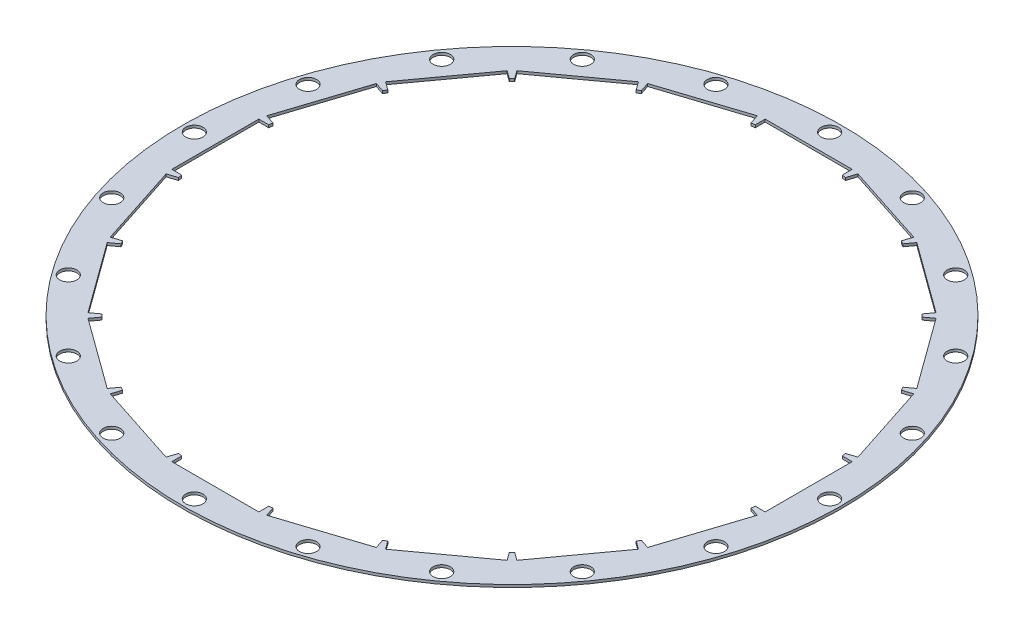
from build123d import *

# Parameters (mm, degrees)
SKETCH1_R           = 2.6
BOSS_EXTRUDE1_DEPTH = 0.79375
CIRPATTERN1_COUNT   = 20


with BuildPart() as part:
    # Sketch1 → Boss-Extrude1 (new body)
    with BuildSketch(Plane(origin=(0, 0, 0), x_dir=(1, 0, 0), z_dir=(0, 1, 0))):
        with BuildLine():
            Line((-15.643446504, 98.76883406), (-13.77106769, 86.947099487))
            Line((-13.77106769, 86.947099487), (-13.2, 87.037547723))
            Line((-13.2, 87.037547723), (-13.2, 90.037547723))
            Line((-13.2, 90.037547723), (13.2, 90.037547723))
            Line((13.2, 90.037547723), (13.2, 87.037547723))
            Line((13.2, 87.037547723), (13.77106769, 86.947099487))
            Line((13.77106769, 86.947099487), (15.643446504, 98.76883406))
            ThreePointArc((15.643446504, 98.76883406), (0, 100), (-15.643446504, 98.76883406))
        make_face()
        with Locations(Location((0, 96.4, 0), (0, 0, 270))):
            Circle(SKETCH1_R, mode=Mode.SUBTRACT)
    extrude(amount=BOSS_EXTRUDE1_DEPTH)


with BuildPart() as cirpattern1_1:
    # CirPattern1: pattern copy
    add(part.part.rotate(Axis((0, 0, 0), (0, 1, 0)), 1 * 360 / CIRPATTERN1_COUNT))


with BuildPart() as cirpattern1_2:
    # CirPattern1: pattern copy
    add(part.part.rotate(Axis((0, 0, 0), (0, 1, 0)), 2 * 360 / CIRPATTERN1_COUNT))


with BuildPart() as cirpattern1_3:
    # CirPattern1: pattern copy
    add(part.part.rotate(Axis((0, 0, 0), (0, 1, 0)), 3 * 360 / CIRPATTERN1_COUNT))


with BuildPart() as cirpattern1_4:
    # CirPattern1: pattern copy
    add(part.part.rotate(Axis((0, 0, 0), (0, 1, 0)), 4 * 360 / CIRPATTERN1_COUNT))


with BuildPart() as cirpattern1_5:
    # CirPattern1: pattern copy
    add(part.part.rotate(Axis((0, 0, 0), (0, 1, 0)), 5 * 360 / CIRPATTERN1_COUNT))


with BuildPart() as cirpattern1_6:
    # CirPattern1: pattern copy
    add(part.part.rotate(Axis((0, 0, 0), (0, 1, 0)), 6 * 360 / CIRPATTERN1_COUNT))


with BuildPart() as cirpattern1_7:
    # CirPattern1: pattern copy
    add(part.part.rotate(Axis((0, 0, 0), (0, 1, 0)), 7 * 360 / CIRPATTERN1_COUNT))


with BuildPart() as cirpattern1_8:
    # CirPattern1: pattern copy
    add(part.part.rotate(Axis((0, 0, 0), (0, 1, 0)), 8 * 360 / CIRPATTERN1_COUNT))


with BuildPart() as cirpattern1_9:
    # CirPattern1: pattern copy
    add(part.part.rotate(Axis((0, 0, 0), (0, 1, 0)), 9 * 360 / CIRPATTERN1_COUNT))


with BuildPart() as cirpattern1_10:
    # CirPattern1: pattern copy
    add(part.part.rotate(Axis((0, 0, 0), (0, 1, 0)), 10 * 360 / CIRPATTERN1_COUNT))


with BuildPart() as cirpattern1_11:
    # CirPattern1: pattern copy
    add(part.part.rotate(Axis((0, 0, 0), (0, 1, 0)), 11 * 360 / CIRPATTERN1_COUNT))


with BuildPart() as cirpattern1_12:
    # CirPattern1: pattern copy
    add(part.part.rotate(Axis((0, 0, 0), (0, 1, 0)), 12 * 360 / CIRPATTERN1_COUNT))


with BuildPart() as cirpattern1_13:
    # CirPattern1: pattern copy
    add(part.part.rotate(Axis((0, 0, 0), (0, 1, 0)), 13 * 360 / CIRPATTERN1_COUNT))


with BuildPart() as cirpattern1_14:
    # CirPattern1: pattern copy
    add(part.part.rotate(Axis((0, 0, 0), (0, 1, 0)), 14 * 360 / CIRPATTERN1_COUNT))


with BuildPart() as cirpattern1_15:
    # CirPattern1: pattern copy
    add(part.part.rotate(Axis((0, 0, 0), (0, 1, 0)), 15 * 360 / CIRPATTERN1_COUNT))


with BuildPart() as cirpattern1_16:
    # CirPattern1: pattern copy
    add(part.part.rotate(Axis((0, 0, 0), (0, 1, 0)), 16 * 360 / CIRPATTERN1_COUNT))


with BuildPart() as cirpattern1_17:
    # CirPattern1: pattern copy
    add(part.part.rotate(Axis((0, 0, 0), (0, 1, 0)), 17 * 360 / CIRPATTERN1_COUNT))


with BuildPart() as cirpattern1_18:
    # CirPattern1: pattern copy
    add(part.part.rotate(Axis((0, 0, 0), (0, 1, 0)), 18 * 360 / CIRPATTERN1_COUNT))


with BuildPart() as cirpattern1_19:
    # CirPattern1: pattern copy
    add(part.part.rotate(Axis((0, 0, 0), (0, 1, 0)), 19 * 360 / CIRPATTERN1_COUNT))

    # Combine1: union CirPattern1_18, CirPattern1_17, CirPattern1_16, CirPattern1_15, CirPattern1_14, CirPattern1_13, CirPattern1_12, CirPattern1_11, CirPattern1_10, CirPattern1_9, CirPattern1_8, CirPattern1_7, CirPattern1_6, CirPattern1_5, CirPattern1_4, CirPattern1_3, CirPattern1_2, CirPattern1_1, part
    add(cirpattern1_18.part)
    add(cirpattern1_17.part)
    add(cirpattern1_16.part)
    add(cirpattern1_15.part)
    add(cirpattern1_14.part)
    add(cirpattern1_13.part)
    add(cirpattern1_12.part)
    add(cirpattern1_11.part)
    add(cirpattern1_10.part)
    add(cirpattern1_9.part)
    add(cirpattern1_8.part)
    add(cirpattern1_7.part)
    add(cirpattern1_6.part)
    add(cirpattern1_5.part)
    add(cirpattern1_4.part)
    add(cirpattern1_3.part)
    add(cirpattern1_2.part)
    add(cirpattern1_1.part)
    add(part.part)


solid = cirpattern1_19.part
